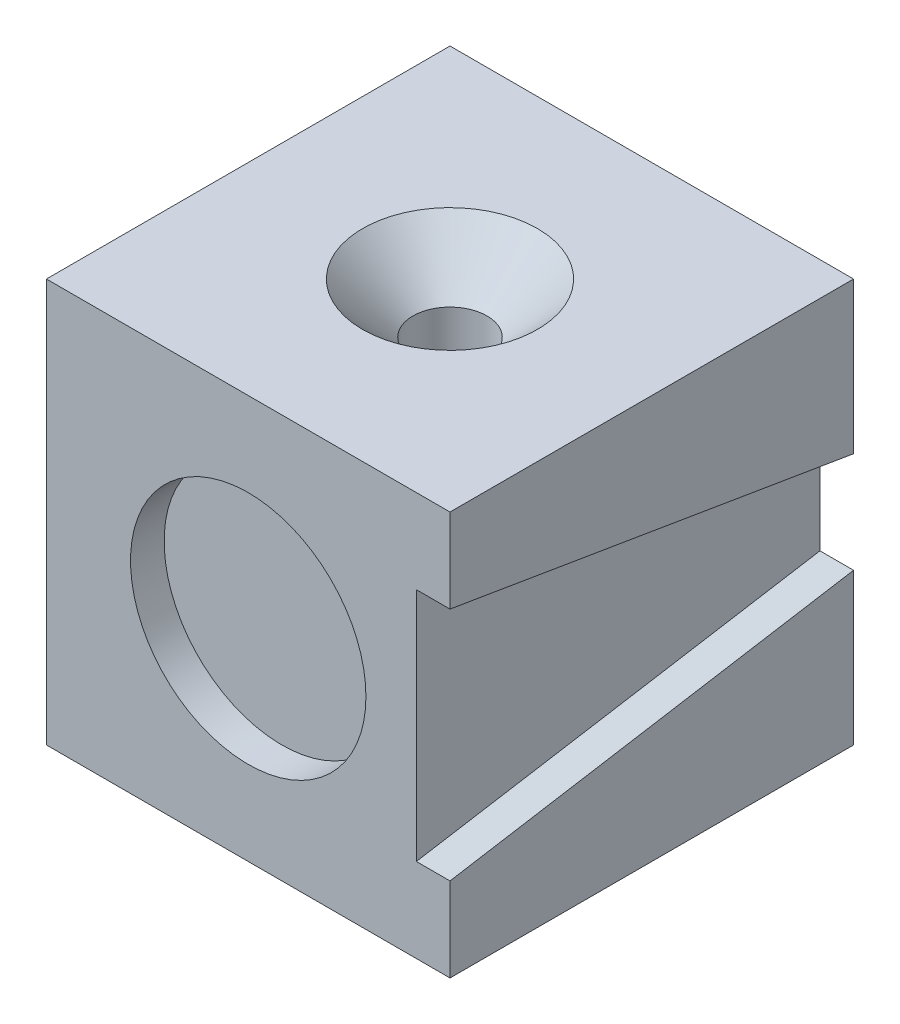
from build123d import *

# Parameters (mm, degrees)
SKETCH1_W           = 152.4
SKETCH1_H           = 152.4
BOSS_EXTRUDE1_DEPTH = 76.2
CUT_EXTRUDE1_DEPTH  = 12.7
SKETCH4_R           = 44.45
CUT_EXTRUDE2_DEPTH  = 12.7
SKETCH5_R           = 25.4
BOSS_EXTRUDE2_DEPTH = 25.4
SKETCH6_W           = 127
SKETCH6_H           = 127
CUT_EXTRUDE3_DEPTH  = 12.7


with BuildPart() as part:
    # Sketch1 → Boss-Extrude1 (new, symmetric)
    with BuildSketch(Plane(origin=(0, 0, 0), x_dir=(1, 0, 0), z_dir=(0, 1, 0))):
        Rectangle(SKETCH1_W, SKETCH1_H)
    extrude(amount=BOSS_EXTRUDE1_DEPTH, both=True)

    # Sketch2 → Cut-Revolve1 (revolve, cut)
    with BuildSketch(Plane.XY, mode=Mode.PRIVATE) as cut_revolve1_sk:
        Polygon((0, 12.7), (13.97, 12.7), (13.97, 57.15), (33.02, 76.2), (0, 76.2), align=None)
    revolve(cut_revolve1_sk.sketch.rotate(Axis((0, 0, 0), (0, 1, 0)), 90), axis=Axis((0, 0, 0), (0, 1, 0)), mode=Mode.SUBTRACT)

    # Sketch3 → Cut-Extrude1 (cut)
    with BuildSketch(Plane(origin=(76.2, 0, 0), x_dir=(0, 0, -1), z_dir=(1, 0, 0))):
        Polygon((-76.2, 44.45), (76.2, 19.05), (76.2, -19.05), (-76.2, -44.45), align=None)
    extrude(amount=-CUT_EXTRUDE1_DEPTH, mode=Mode.SUBTRACT)

    # Sketch4 → Cut-Extrude2 (cut)
    with BuildSketch(Plane.XY.offset(76.2)):
        Circle(SKETCH4_R)
    extrude(amount=-CUT_EXTRUDE2_DEPTH, mode=Mode.SUBTRACT)

    # Sketch5 → Boss-Extrude2 (add)
    with BuildSketch(Plane(origin=(0, 0, -76.2), x_dir=(-1, 0, 0), z_dir=(0, 0, -1))):
        with Locations(Location((0, 0, 0), (0, 0, 180))):
            Circle(SKETCH5_R)
    extrude(amount=BOSS_EXTRUDE2_DEPTH)

    # Sketch6 → Cut-Extrude3 (cut)
    with BuildSketch(Plane.ZY.offset(76.2)):
        Rectangle(SKETCH6_W, SKETCH6_H)
    extrude(amount=-CUT_EXTRUDE3_DEPTH, mode=Mode.SUBTRACT)


solid = part.part
